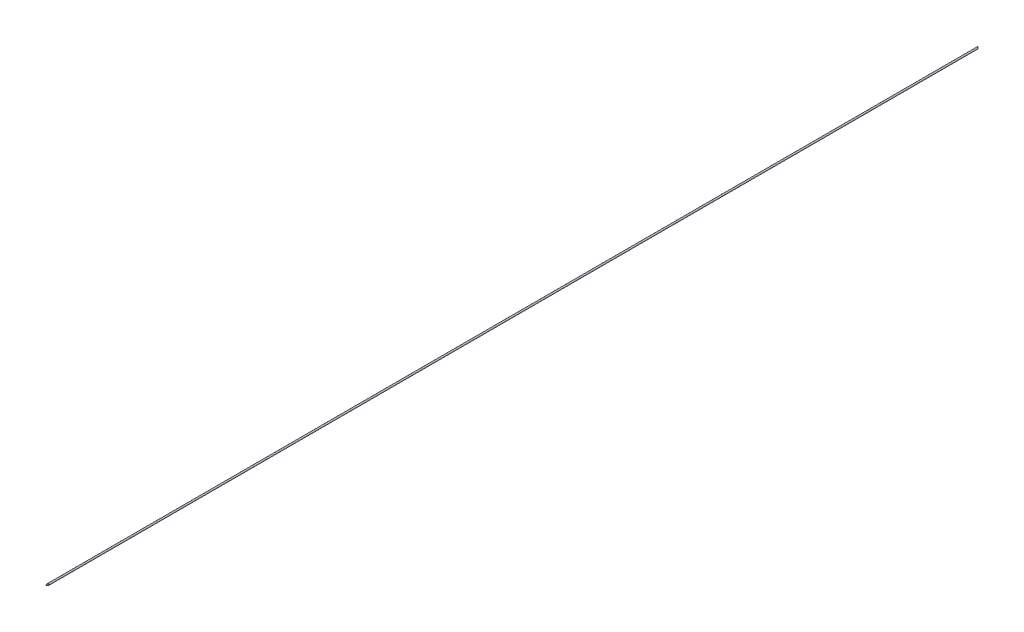
from build123d import *

# Parameters (mm, degrees)
ESBO_O1_R                = 5
RESSALTO_EXTRUS_O1_DEPTH = 2920
CORTE_EXTRUS_O1_DEPTH    = 5


with BuildPart() as part:
    # Esboço1 → Ressalto-extrusão1 (new, symmetric)
    with BuildSketch(Plane.XY):
        with Locations(Location((0, 0, 0), (0, 0, 180))):
            Circle(ESBO_O1_R)
    extrude(amount=RESSALTO_EXTRUS_O1_DEPTH, both=True)

    # Esboço2 → Corte-extrusão1 (cut, symmetric)
    with BuildSketch(Plane(origin=(0, 0, 0), x_dir=(1, 0, 0), z_dir=(0, 1, 0))):
        Polygon((-5, -2920), (5, -2920), (5, -2910), align=None)
    corte_extrus_o1 = extrude(amount=CORTE_EXTRUS_O1_DEPTH, both=True, mode=Mode.SUBTRACT)

    # Espelhar1: Corte-extrusão1 across plane
    add(corte_extrus_o1.mirror(Plane.XY), mode=Mode.SUBTRACT)


solid = part.part
